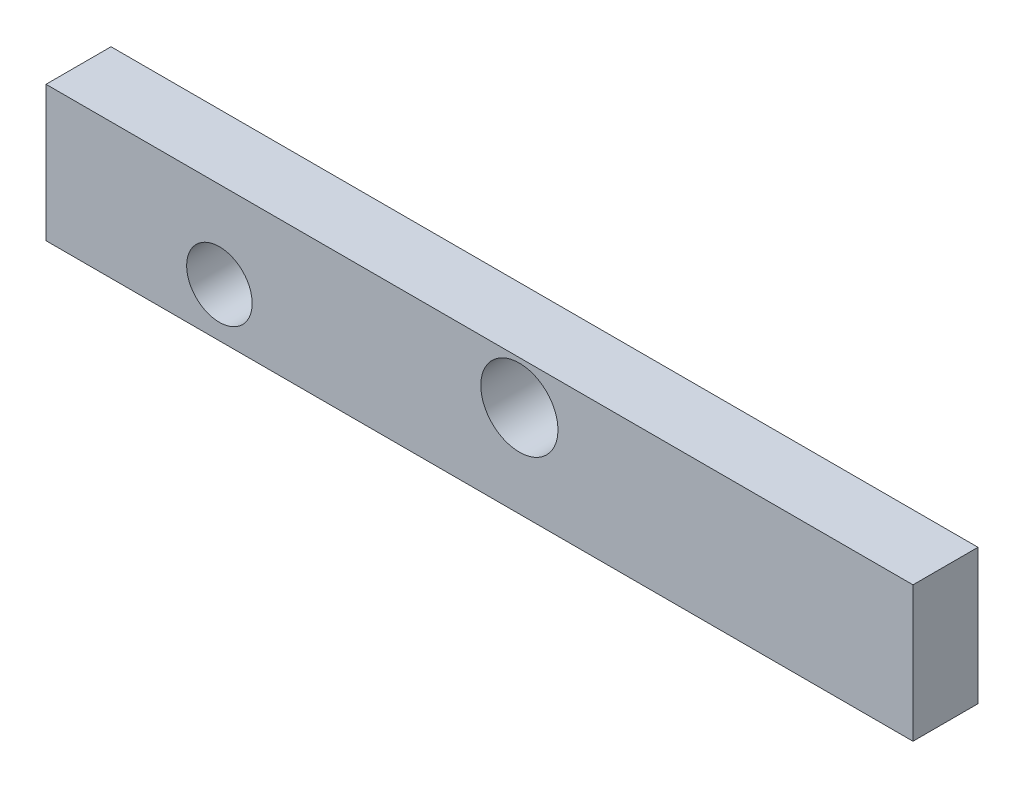
from build123d import *

# Parameters (mm, degrees)
SKETCH1_W           = 127
SKETCH1_H           = 44.45
BOSS_EXTRUDE1_DEPTH = 9.525
SKETCH6_R           = 4.8
CUT_EXTRUDE1_DEPTH  = 68.947967225
SKETCH10_R          = 2.286
CUT_EXTRUDE2_DEPTH  = 3.81
SKETCH13_W          = 127
SKETCH13_H          = 49.203053771
CUT_EXTRUDE3_DEPTH  = 68.947967225
SKETCH15_R          = 5.652121823
CUT_EXTRUDE4_DEPTH  = 68.947967225


with BuildPart() as part:
    # Sketch1 → Boss-Extrude1 (new body)
    with BuildSketch(Plane.XY):
        Rectangle(SKETCH1_W, SKETCH1_H)
    extrude(amount=BOSS_EXTRUDE1_DEPTH)

    # Sketch6 → Cut-Extrude1 (cut, through all)
    with BuildSketch(Plane.XY):
        with Locations(Location((-38.1, 9.525, 0), (0, 0, 180))):
            Circle(SKETCH6_R)
    extrude(amount=CUT_EXTRUDE1_DEPTH, mode=Mode.SUBTRACT)

    # Sketch10 → Cut-Extrude2 (cut)
    with BuildSketch(Plane.XY.offset(9.525)):
        with Locations((-46.11545283, -16.764)):
            Circle(SKETCH10_R)
    extrude(amount=-CUT_EXTRUDE2_DEPTH, mode=Mode.SUBTRACT)

    # Sketch13 → Cut-Extrude3 (cut, through all)
    with BuildSketch(Plane(origin=(0, 0, 0), x_dir=(-1, 0, 0), z_dir=(0, 0, -1))):
        with Locations((0, -22.225000001)):
            Rectangle(SKETCH13_W, SKETCH13_H)
    extrude(amount=-CUT_EXTRUDE3_DEPTH, mode=Mode.SUBTRACT)

    # Sketch15 → Cut-Extrude4 (cut, through all)
    with BuildSketch(Plane(origin=(0, 0, 0), x_dir=(-1, 0, 0), z_dir=(0, 0, -1))):
        with Locations((-5.842, 15.875)):
            Circle(SKETCH15_R)
    extrude(amount=-CUT_EXTRUDE4_DEPTH, mode=Mode.SUBTRACT)


solid = part.part
